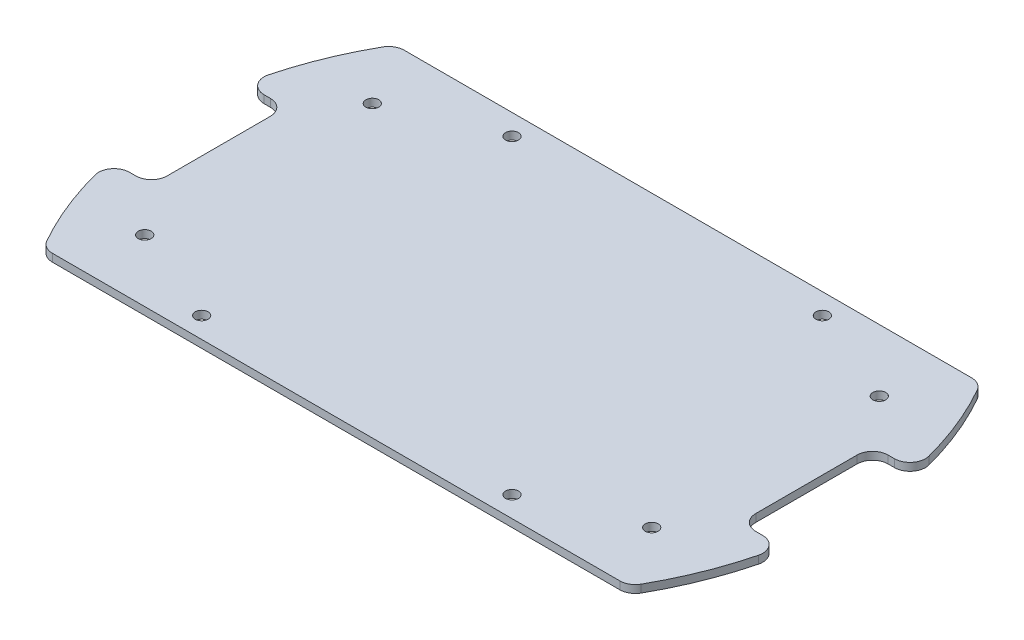
from build123d import *

# Parameters (mm, degrees)
EXTRUDE_2_DEPTH             = 1.5
M3X0_5_1_D                  = 2.5
M3X0_5_1_DEPTH              = 4
M3X0_5_1_TIP                = 0.751075774
M3X0_5_1_ON_FACE_2_D        = 2.5
M3X0_5_1_ON_FACE_2_DEPTH    = 4
M3X0_5_1_ON_FACE_2_TIP      = 0.751075774
PATTERN_LINEAR_1_COUNT      = 2
PATTERN_LINEAR_1_PITCH      = 98
PATTERN_LINEAR_1_COUNT_DIR2 = 2
PATTERN_LINEAR_1_PITCH_DIR2 = 44
FILLET_1_R                  = 3


with BuildPart() as part:
    # 草圖10 → 填料-伸長2 (new body)
    with BuildSketch(Plane(origin=(0, 0, 0), x_dir=(1, 0, 0), z_dir=(0, 1, 0))):
        with BuildLine():
            Line((56.568542495, 34), (-56.568542495, 34))
            ThreePointArc((-56.568542495, 34), (-61.540159626, 23.849711805), (-64.707032075, 13))
            Line((-64.707032075, 13), (-56.707032075, 13))
            Line((-56.707032075, 13), (-56.707032075, -12.973279994))
            Line((-56.707032075, -12.973279994), (-64.707032075, -13))
            ThreePointArc((-64.707032075, -13), (-61.540159626, -23.849711805), (-56.568542495, -34))
            Line((-56.568542495, -34), (56.568542495, -34))
            ThreePointArc((56.568542495, -34), (61.619473981, -23.644035746), (64.792427449, -12.567471713))
            Line((64.792427449, -12.567471713), (56.707032075, -12.594476939))
            Line((56.707032075, -12.594476939), (56.707032075, 13))
            Line((56.707032075, 13), (64.707032075, 13))
            ThreePointArc((64.707032075, 13), (61.540159626, 23.849711805), (56.568542495, 34))
        make_face()
    extrude(amount=EXTRUDE_2_DEPTH)

    # M3x0.5  螺絲攻的螺孔鑽1
    with Locations(Plane(origin=(30, 1.5, 30), x_dir=(0, 0, 1), z_dir=(0, 1, 0))):
        with Locations((0, 0), (-60, -60), (0, -60), (-60, 0)):
            Hole(M3X0_5_1_D / 2, depth=M3X0_5_1_DEPTH)
            with Locations((0, 0, -(M3X0_5_1_DEPTH + M3X0_5_1_TIP / 2))):  # 118° drill point
                Cone(0, M3X0_5_1_D / 2, M3X0_5_1_TIP, mode=Mode.SUBTRACT)

    # M3x0.5  螺絲攻的螺孔鑽1 on face 2
    with Locations(Plane(origin=(-30, 0, -30), x_dir=(0, 0, -1), z_dir=(0, -1, 0))):
        with Locations((0, 0)):
            Hole(M3X0_5_1_ON_FACE_2_D / 2, depth=M3X0_5_1_ON_FACE_2_DEPTH)
            with Locations((0, 0, -(M3X0_5_1_ON_FACE_2_DEPTH + M3X0_5_1_ON_FACE_2_TIP / 2))):  # 118° drill point
                Cone(0, M3X0_5_1_ON_FACE_2_D / 2, M3X0_5_1_ON_FACE_2_TIP, mode=Mode.SUBTRACT)

    # 草圖14 → M3x0.5  螺絲攻的螺孔鑽2 (revolve, cut)
    with BuildSketch(Plane(origin=(-49, 1.5, -22), x_dir=(0, 0, 1), z_dir=(1, 0, 0))):
        Polygon((0, 0), (0, 4.751075774), (1.25, 4), (1.25, 0), align=None)
    m3x0_5_2 = revolve(axis=Axis((-49, 7.85, -22), (0, -1, 0)), mode=Mode.SUBTRACT)

    # 直線複製排列1: M3x0.5 _2 2 × 2
    with Locations(*[(i * PATTERN_LINEAR_1_PITCH, 0, j * PATTERN_LINEAR_1_PITCH_DIR2) for i in range(PATTERN_LINEAR_1_COUNT) for j in range(PATTERN_LINEAR_1_COUNT_DIR2) if (i, j) != (0, 0)]):
        add(m3x0_5_2, mode=Mode.SUBTRACT)

    # 圓角1
    fillet_1_edges = [part.edges().sort_by_distance(p)[0] for p in [
        (-56.707032075, 0.75, -13),
        (-64.707032075, 0.75, -13),
        (-56.568542495, 0.75, -34),
        (56.568542495, 0.75, -34),
        (64.707032075, 0.75, -13),
        (56.707032075, 0.75, -13),
        (56.707032075, 0.75, 12.594476939),
        (64.792427449, 0.75, 12.567471713),
        (56.568542495, 0.75, 34),
        (-56.568542495, 0.75, 34),
        (-64.707032075, 0.75, 13),
        (-56.707032075, 0.75, 12.973279994),
    ]]
    fillet(fillet_1_edges, radius=FILLET_1_R)


solid = part.part
